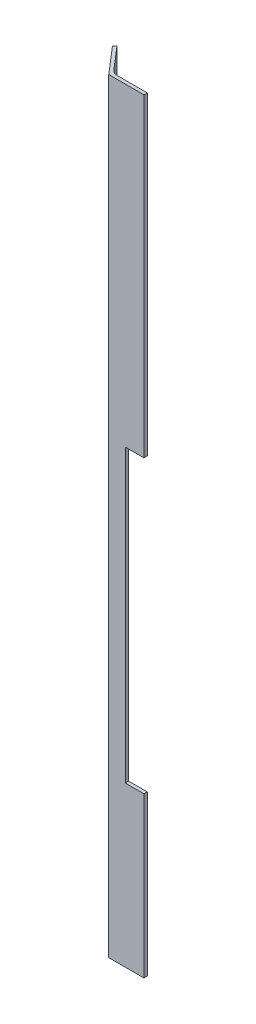
from build123d import *

# Parameters (mm, degrees)
EXTRUDE_START       = 40
EXTRUDE_1_DEPTH     = 460
SKETCH_2_W          = 13.894074778
SKETCH_2_H          = 174.961932369
CUT_EXTRUDE_1_DEPTH = 501.611575003


with BuildPart() as part:
    # Эскиз1 → Вытянуть1 (new body)
    with BuildSketch(Plane(origin=(0, 0, 0), x_dir=(1, 0, 0), z_dir=(0, 1, 0)).offset(EXTRUDE_START)):
        with BuildLine():
            Line((-17.766709847, 14.4460477), (-16.308397656, 15.700046652))
            Line((-16.308397656, 15.700046652), (-4.722880617, 2.226908794))
            ThreePointArc((-4.722880617, 2.226908794), (-3.017444081, 0.942662024), (-0.931762463, 0.48688167))
            Line((-0.931762463, 0.48688167), (17.122829042, 0.48688167))
            Line((17.122829042, 0.48688167), (17.122829042, -1.51311833))
            Line((17.122829042, -1.51311833), (-4.043463493, -1.51311833))
            Line((-4.043463493, -1.51311833), (-17.766709847, 14.4460477))
        make_face()
    extrude(amount=EXTRUDE_1_DEPTH)

    # Эскиз2 → Вырез-Вытянуть1 (cut, through all)
    with BuildSketch(Plane.XY.offset(1.51311833)):
        with Locations((12.875765805, 223.422280108)):
            Rectangle(SKETCH_2_W, SKETCH_2_H)
    extrude(amount=-CUT_EXTRUDE_1_DEPTH, mode=Mode.SUBTRACT)


solid = part.part
